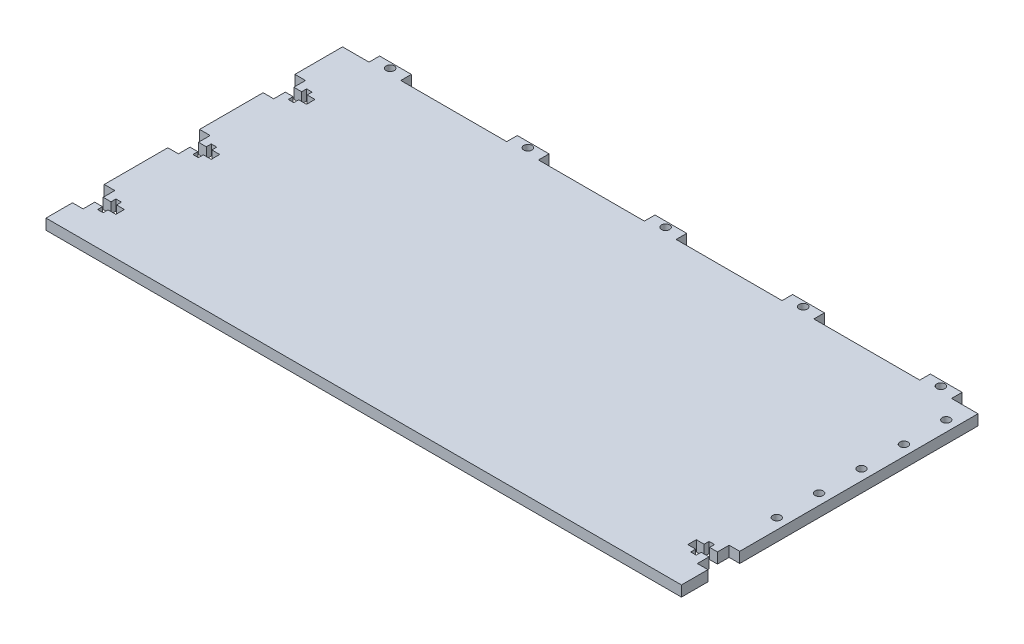
from build123d import *

# Parameters (mm, degrees)
SKETCH1_W                    = 381
SKETCH1_H                    = 177.8
BOSS_EXTRUDE1_DEPTH          = 6.35
SKETCH2_W                    = 19.05
SKETCH2_H                    = 6.35
BOSS_EXTRUDE2_DEPTH          = 6.35
F_10_0_1935_DIAMETER_HOLE1_D = 4.9149
LPATTERN1_COUNT              = 5
LPATTERN1_PITCH              = 82.55
CUT_EXTRUDE2_DEPTH           = 424.216900655
LPATTERN4_COUNT              = 3
LPATTERN4_PITCH              = 57.15
SKETCH8_R                    = 2.413
CUT_EXTRUDE3_DEPTH           = 424.216900655


with BuildPart() as part:
    # Sketch1 → Boss-Extrude1 (new body)
    with BuildSketch(Plane(origin=(0, 0, 0), x_dir=(1, 0, 0), z_dir=(0, 1, 0))):
        with Locations((190.5, 88.9)):
            Rectangle(SKETCH1_W, SKETCH1_H)
    extrude(amount=BOSS_EXTRUDE1_DEPTH)

    # Sketch2 → Boss-Extrude2 (add)
    with BuildSketch(Plane(origin=(0, 6.35, 0), x_dir=(1, 0, 0), z_dir=(0, 1, 0))):
        with Locations((25.4, 180.975)):
            Rectangle(SKETCH2_W, SKETCH2_H)
    boss_extrude2 = extrude(amount=-BOSS_EXTRUDE2_DEPTH)

    # #10 (0.1935) Diameter Hole1 (through all)
    with Locations(Plane(origin=(0, 6.35, 0), x_dir=(1, 0, 0), z_dir=(0, 1, 0))):
        with Locations((25.4, 180.975)):
            f_10_0_1935_diameter_hole1 = Hole(F_10_0_1935_DIAMETER_HOLE1_D / 2)

    # LPattern1: Boss-Extrude2, #10 (0.1935) Diameter Hole1 ×5
    with Locations(*[(i * LPATTERN1_PITCH, 0, 0) for i in range(1, LPATTERN1_COUNT)]):
        add(boss_extrude2)
        add(f_10_0_1935_diameter_hole1, mode=Mode.SUBTRACT)

    # Sketch7 → Cut-Extrude2 (cut, through all)
    with BuildSketch(Plane(origin=(0, 6.35, 0), x_dir=(1, 0, 0), z_dir=(0, 1, 0))):
        Polygon((0, 34.925), (0, 15.875), (6.35, 15.875), (6.35, 22.86), (11.049, 22.86), (11.049, 19.9009), (14.351, 19.9009), (14.351, 22.86), (19.05, 22.86), (19.05, 27.94), (14.351, 27.94), (14.351, 30.8991), (11.049, 30.8991), (11.049, 27.94), (6.35, 27.94), (6.35, 34.925), align=None)
    cut_extrude2 = extrude(amount=-CUT_EXTRUDE2_DEPTH, mode=Mode.SUBTRACT)

    # Mirror2: Cut-Extrude2 across plane
    add(cut_extrude2.mirror(Plane.ZY.offset(-190.5)), mode=Mode.SUBTRACT)

    # LPattern4: Cut-Extrude2 ×3
    with Locations(*[(0, 0, -i * LPATTERN4_PITCH) for i in range(1, LPATTERN4_COUNT)]):
        add(cut_extrude2, mode=Mode.SUBTRACT)

    # Sketch8 → Cut-Extrude3 (cut, through all)
    with BuildSketch(Plane(origin=(0, 6.35, 0), x_dir=(1, 0, 0), z_dir=(0, 1, 0))):
        with Locations(Location((374.65, 165.1, 0), (0, 0, 270))):
            Circle(SKETCH8_R)
        with Locations(Location((374.65, 139.7, 0), (0, 0, 270))):
            Circle(SKETCH8_R)
        with Locations(Location((374.65, 114.3, 0), (0, 0, 270))):
            Circle(SKETCH8_R)
        with Locations(Location((374.65, 88.9, 0), (0, 0, 270))):
            Circle(SKETCH8_R)
        with Locations(Location((374.65, 63.5, 0), (0, 0, 270))):
            Circle(SKETCH8_R)
    extrude(amount=-CUT_EXTRUDE3_DEPTH, mode=Mode.SUBTRACT)


solid = part.part
